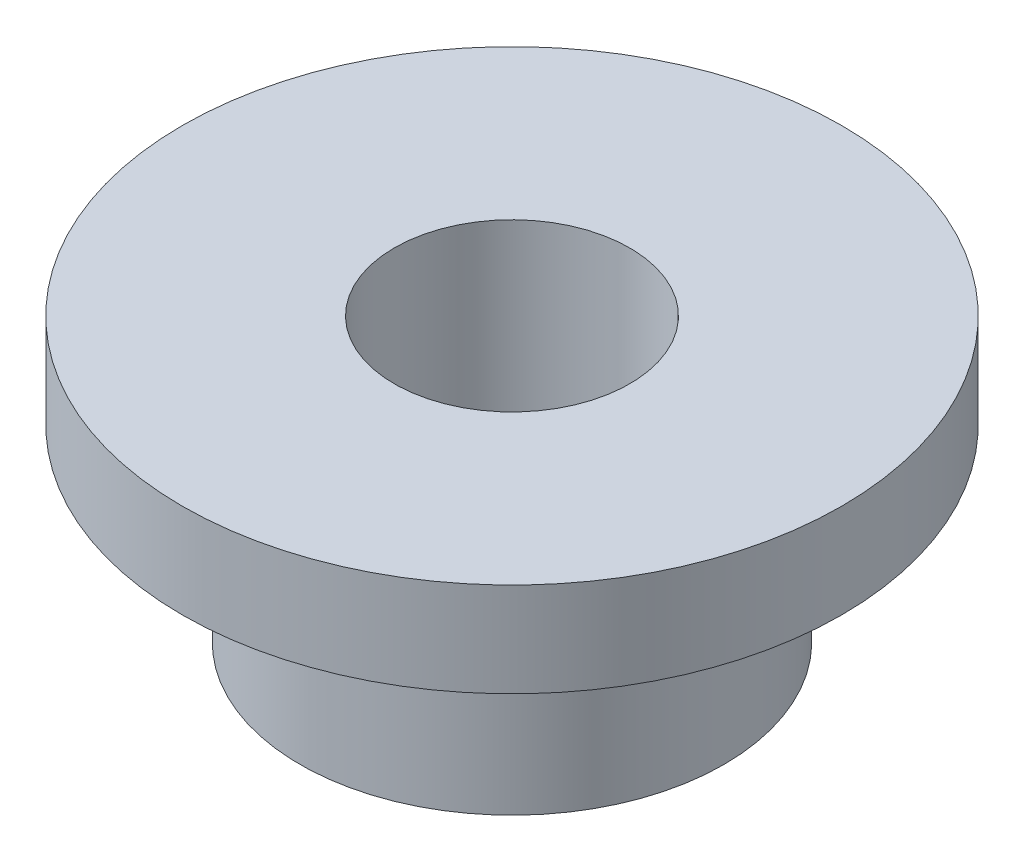
from build123d import *


with BuildPart() as part:
    # 草图1 → 旋转1 (revolve)
    with BuildSketch(Plane.XY, mode=Mode.PRIVATE) as revolve_1_sk:
        Polygon((0, 0), (18, 0), (18, -8), (8, -8), (8, -24), (0, -24), align=None)
    revolve(revolve_1_sk.sketch.rotate(Axis((-10, 2.696458073, 0), (0, -1, 0)), 180), axis=Axis((-10, 2.696458073, 0), (0, -1, 0)))


solid = part.part
